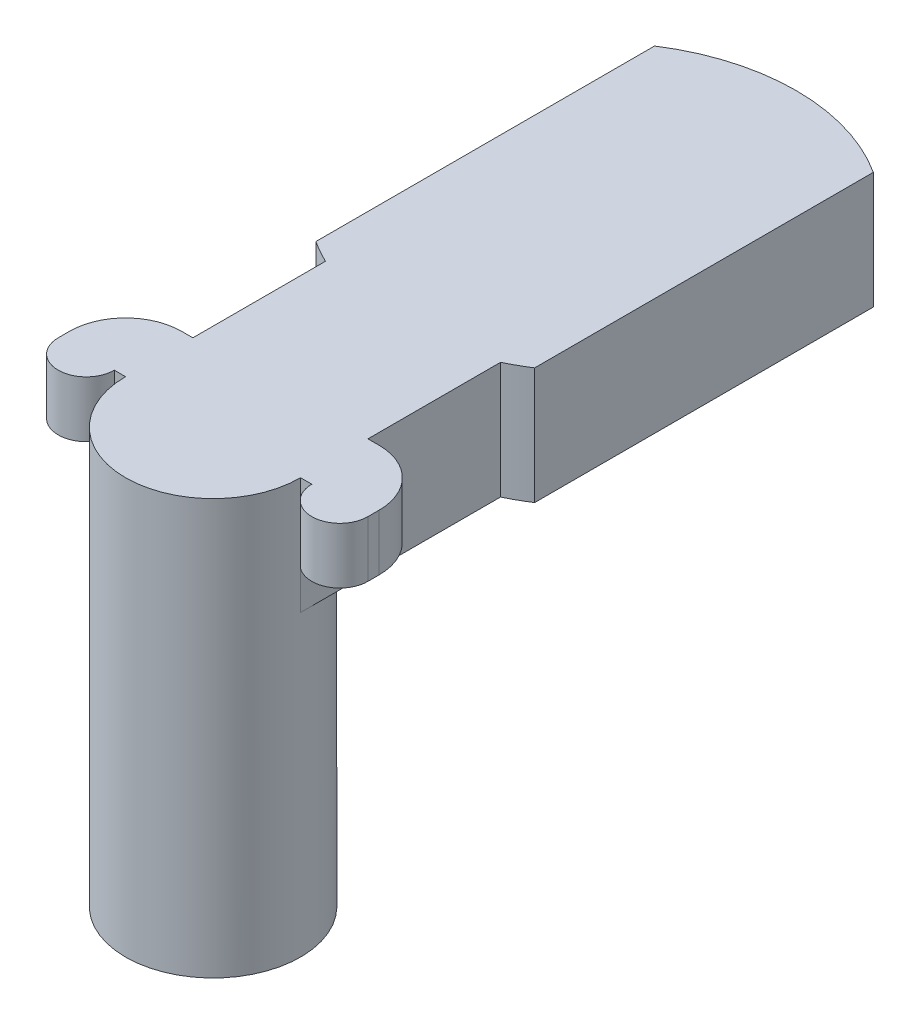
from build123d import *

# Parameters (mm, degrees)
BOSS_EXTRUDE1_DEPTH = 5.2
SKETCH5_W           = 7.8
SKETCH5_H           = 5.2
BOSS_EXTRUDE2_DEPTH = 17
SKETCH6_R           = 3.9
BOSS_EXTRUDE3_DEPTH = 18.5
BOSS_EXTRUDE4_DEPTH = 2.5
SKETCH8_R           = 1.6
CUT_EXTRUDE1_DEPTH  = 5


with BuildPart() as part:
    # Sketch3 → Boss-Extrude1 (new body)
    with BuildSketch(Plane(origin=(0, 0, 0), x_dir=(1, 0, 0), z_dir=(0, 1, 0))):
        with BuildLine():
            Line((-4.875, 7.545253061), (-4.875, -7.545253061))
            ThreePointArc((-4.875, -7.545253061), (0, -8.983121325), (4.875, -7.545253061))
            Line((4.875, -7.545253061), (4.875, 7.545253061))
            ThreePointArc((4.875, 7.545253061), (0, 8.983121325), (-4.875, 7.545253061))
        make_face()
    extrude(amount=BOSS_EXTRUDE1_DEPTH)

    # Sketch5 → Boss-Extrude2 (add)
    with BuildSketch(Plane.XY):
        with Locations((0, 2.6)):
            Rectangle(SKETCH5_W, SKETCH5_H)
    extrude(amount=BOSS_EXTRUDE2_DEPTH)

    # Sketch6 → Boss-Extrude3 (add)
    with BuildSketch(Plane(origin=(0, 5.2, 0), x_dir=(1, 0, 0), z_dir=(0, 1, 0))):
        with Locations(Location((0, -17, 0), (0, 0, 270))):
            Circle(SKETCH6_R)
    extrude(amount=-BOSS_EXTRUDE3_DEPTH)

    # Sketch7 → Boss-Extrude4 (add)
    with BuildSketch(Plane(origin=(0, 5.2, 0), x_dir=(1, 0, 0), z_dir=(0, 1, 0))):
        with BuildLine():
            Line((-4.4, -14), (4.4, -14))
            ThreePointArc((4.4, -14), (6.167766953, -14.732233047), (6.9, -16.5))
            Line((6.9, -16.5), (6.9, -17))
            ThreePointArc((6.9, -17), (5.65, -18.25), (4.4, -17))
            Line((4.4, -17), (-4.4, -17))
            ThreePointArc((-4.4, -17), (-5.65, -18.25), (-6.9, -17))
            Line((-6.9, -17), (-6.9, -16.5))
            ThreePointArc((-6.9, -16.5), (-6.167766953, -14.732233047), (-4.4, -14))
        make_face()
    extrude(amount=-BOSS_EXTRUDE4_DEPTH)

    # Sketch8 → Cut-Extrude1 (cut)
    with BuildSketch(Plane.XZ.offset(13.3)):
        with Locations(Location((0, 17, 0), (0, 0, 270))):
            Circle(SKETCH8_R)
    extrude(amount=-CUT_EXTRUDE1_DEPTH, mode=Mode.SUBTRACT)


solid = part.part
